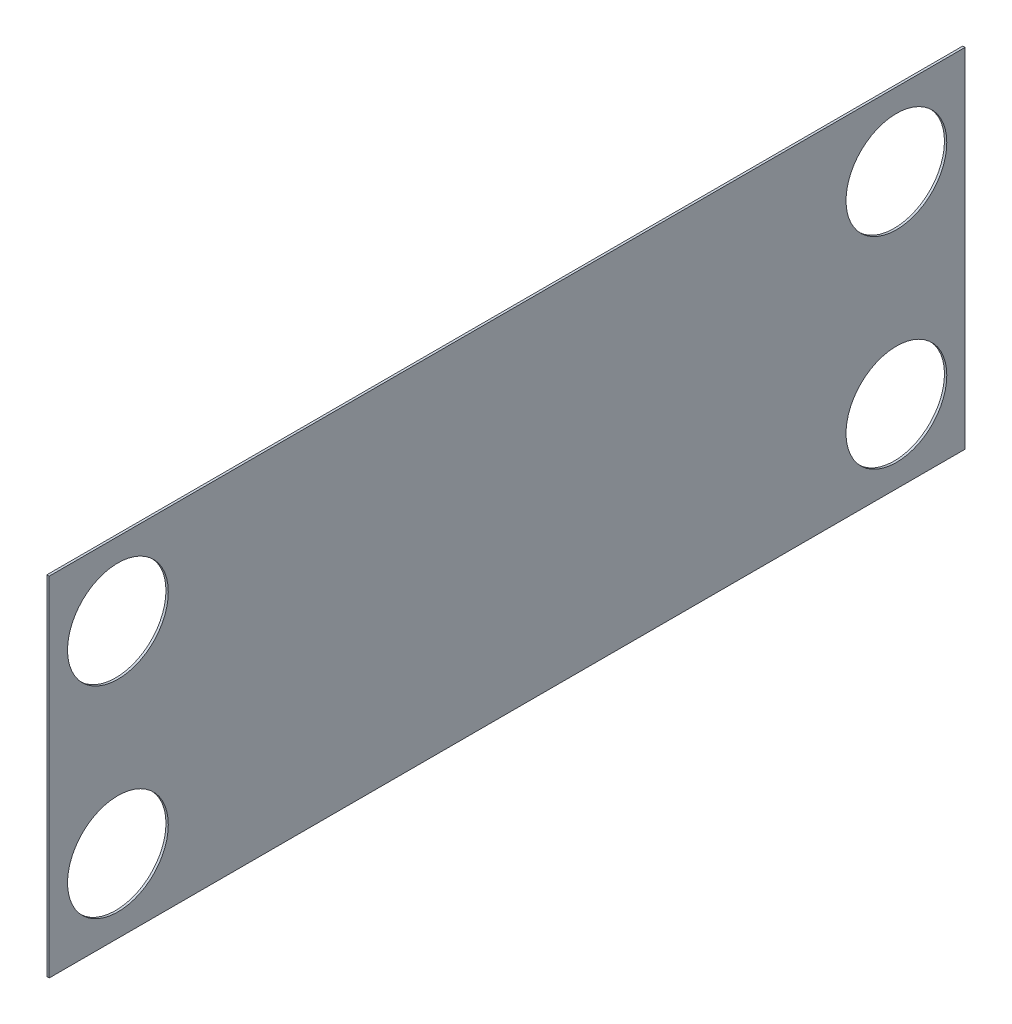
from build123d import *

# Parameters (mm, degrees)
SKETCH1_W             = 100
SKETCH1_H             = 38
BOSS_EXTRUDE1_DEPTH   = 0.254
M10_CLEARANCE_HOLE1_D = 11


with BuildPart() as part:
    # Sketch1 → Boss-Extrude1 (new body)
    with BuildSketch(Plane(origin=(0, 0, 0), x_dir=(0, 0, -1), z_dir=(1, 0, 0))):
        Rectangle(SKETCH1_W, SKETCH1_H)
    extrude(amount=BOSS_EXTRUDE1_DEPTH)

    # M10 Clearance Hole1 (through all)
    with Locations(Plane(origin=(0.254, 0, 0), x_dir=(0, 0, -1), z_dir=(1, 0, 0))):
        with Locations((-42.5, 11), (-42.5, -11), (42.5, 11), (42.5, -11)):
            Hole(M10_CLEARANCE_HOLE1_D / 2)


solid = part.part
